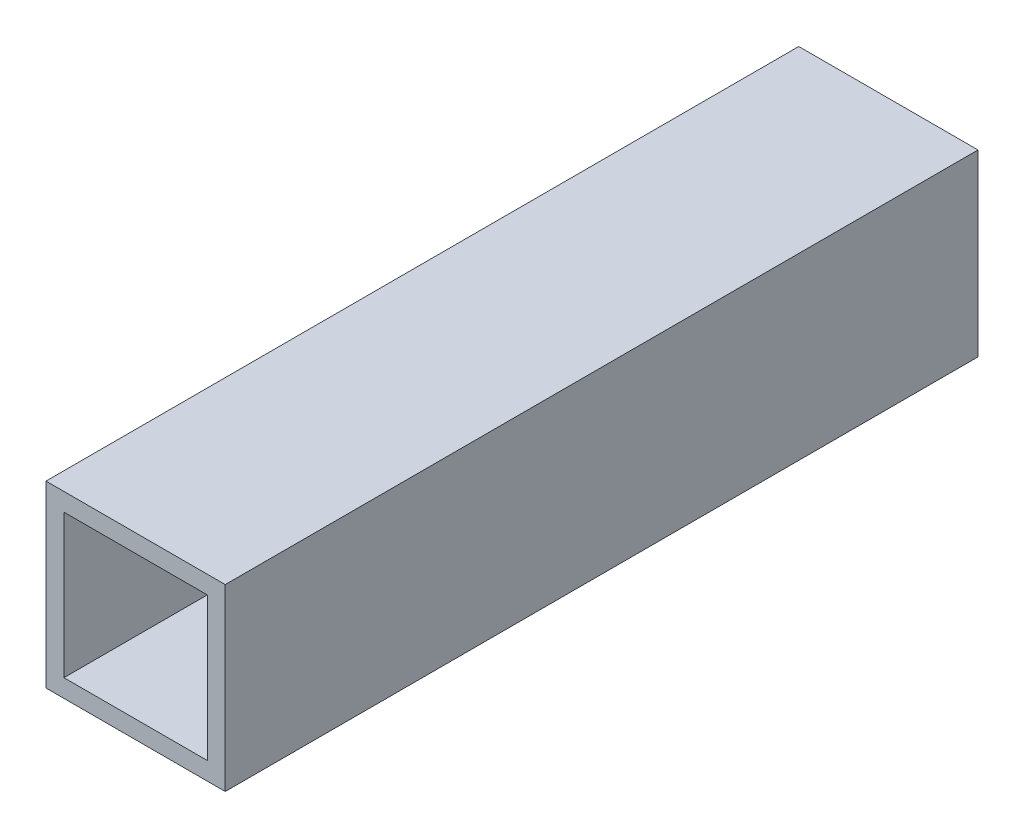
from build123d import *

# Parameters (mm, degrees)
SKETCH_1_W      = 20
SKETCH_1_H      = 20
SKETCH_1_W_2    = 16
SKETCH_1_H_2    = 16
EXTRUDE_1_DEPTH = 84


with BuildPart() as part:
    # 草图1 → 凸台-拉伸1 (new body)
    with BuildSketch(Plane.XY):
        Rectangle(SKETCH_1_W, SKETCH_1_H)
        Rectangle(SKETCH_1_W_2, SKETCH_1_H_2, mode=Mode.SUBTRACT)
    extrude(amount=EXTRUDE_1_DEPTH)


solid = part.part
